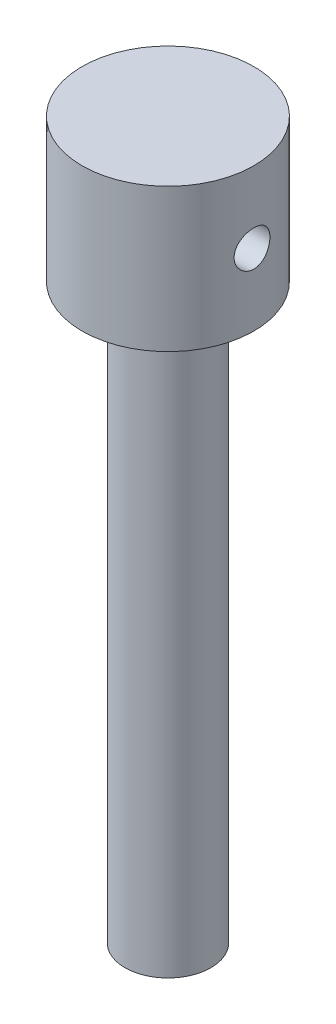
from build123d import *

# Parameters (mm, degrees)
SKETCH2_R               = 12
SKETCH2_R_2             = 6
BOSS_EXTRUDE2_DEPTH     = 20
SKETCH2_2_R             = 6
BOSS_EXTRUDE3_DEPTH     = 100
CUT_EXTRUDE1_DEPTH      = 102.429778665
CUT_EXTRUDE1_DEPTH_BACK = 102.429778665
SKETCH3_R               = 2.5


with BuildPart() as part:
    # Sketch2 → Boss-Extrude2 (new body)
    with BuildSketch(Plane(origin=(0, 0, 0), x_dir=(1, 0, 0), z_dir=(0, 1, 0))):
        Circle(SKETCH2_R)
        Circle(SKETCH2_R_2, mode=Mode.SUBTRACT)
    extrude(amount=-BOSS_EXTRUDE2_DEPTH)

    # Sketch2<2> → Boss-Extrude3 (add)
    with BuildSketch(Plane(origin=(0, 0, 0), x_dir=(1, 0, 0), z_dir=(0, 1, 0))):
        Circle(SKETCH2_2_R)
    extrude(amount=-BOSS_EXTRUDE3_DEPTH)

    # Sketch3 → Cut-Extrude1 (cut, two sides: drawn at the far end of the back side and taken through both)
    with BuildSketch(Plane(origin=(0, 0, 0), x_dir=(0, 0, -1), z_dir=(1, 0, 0)).offset(-CUT_EXTRUDE1_DEPTH_BACK)):
        with Locations((0, -10)):
            Circle(SKETCH3_R)
    extrude(amount=CUT_EXTRUDE1_DEPTH + CUT_EXTRUDE1_DEPTH_BACK, mode=Mode.SUBTRACT)


solid = part.part
